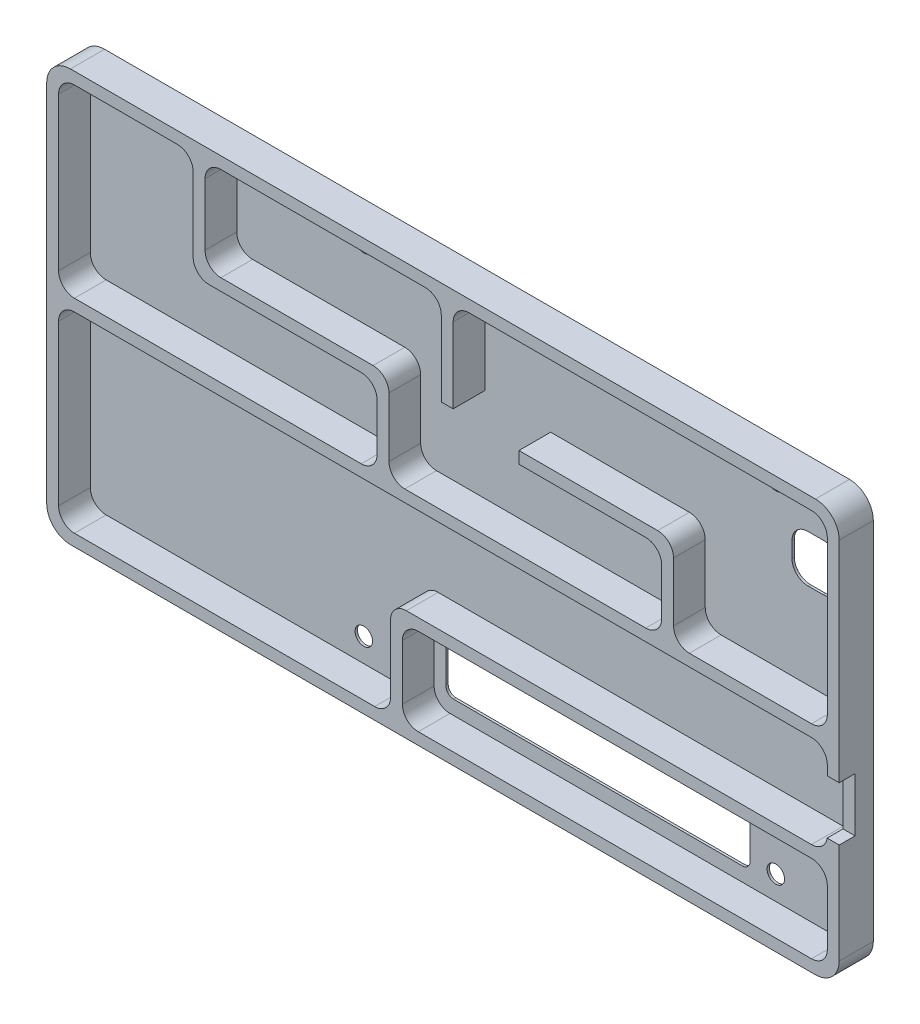
from build123d import *

# Parameters (mm, degrees)
SKETCH_1_W           = 99.974800609
SKETCH_1_H           = 51.97470409
EXTRUDE_1_DEPTH      = 8.6
SKETCH_2_W           = 95.974800609
SKETCH_2_H           = 47.97470409
CUT_EXTRUDE_1_DEPTH  = 4
SKETCH_3_W           = 2
SKETCH_3_H           = 10
SKETCH_3_H_2         = 9.97470409
CUT_EXTRUDE_2_DEPTH  = 3.35
SKETCH_4_R           = 1.1
SKETCH_4_W           = 38.392586289
SKETCH_4_H           = 7.4
SKETCH_4_W_2         = 5.95
SKETCH_4_H_2         = 5.95
CUT_EXTRUDE_3_DEPTH  = 1437.448457956
FILLET_1_R           = 3
FILLET_3_R           = 2
SKETCH_12_W          = 9.000025401
SKETCH_12_H          = 9.0000508
EXTRUDE_3_DEPTH      = 2.7
SKETCH_13_W          = 16.992125984
SKETCH_13_H          = 17.047314393
EXTRUDE_4_DEPTH      = 1.9
SKETCH_7_W           = 53.6
SKETCH_7_H           = 10.97470409
CUT_EXTRUDE_14_DEPTH = 4
FILLET_7_R           = 2
FILLET_8_R           = 1
SKETCH_14_W          = 2.323736835
SKETCH_14_H          = 6.8
CUT_EXTRUDE_15_DEPTH = 2
SKETCH_15_W          = 4.3
SKETCH_15_H          = 51.97470409
CUT_EXTRUDE_16_DEPTH = 1490.156636733


with BuildPart() as part:
    # 草图1 → 凸台-拉伸1 (new body)
    with BuildSketch(Plane.XY.offset(1046.483288979)):
        with Locations((934.375963031, 1020.144466268)):
            Rectangle(SKETCH_1_W, SKETCH_1_H)
    extrude(amount=EXTRUDE_1_DEPTH)

    # 草图2 → 切除-拉伸1 (cut)
    with BuildSketch(Plane(origin=(0, 0, 1046.483288979), x_dir=(-1, 0, 0), z_dir=(0, 0, -1))):
        with Locations((-934.375963031, 1020.144466268)):
            Rectangle(SKETCH_2_W, SKETCH_2_H)
    extrude(amount=-CUT_EXTRUDE_1_DEPTH, mode=Mode.SUBTRACT)

    # 草图3 → 切除-拉伸2 (cut)
    with BuildSketch(Plane(origin=(0, 0, 1046.483288979), x_dir=(-1, 0, 0), z_dir=(0, 0, -1))):
        with Locations((-885.388562726, 1034.131818313)):
            Rectangle(SKETCH_3_W, SKETCH_3_H)
        with Locations((-885.388562726, 1020.144466268)):
            Rectangle(SKETCH_3_W, SKETCH_3_H_2)
        with Locations((-885.388562726, 1006.157114223)):
            Rectangle(SKETCH_3_W, SKETCH_3_H)
    extrude(amount=-CUT_EXTRUDE_2_DEPTH, mode=Mode.SUBTRACT)

    # 草图4 → 切除-拉伸3 (cut, through all)
    with BuildSketch(Plane(origin=(0, 0, 1050.483288979), x_dir=(-1, 0, 0), z_dir=(0, 0, -1))):
        with Locations((-920.388562726, 1041.631818313)):
            Circle(SKETCH_4_R)
        with Locations((-920.388562726, 998.657114223)):
            Circle(SKETCH_4_R)
        with Locations((-972.363363335, 998.657114223)):
            Circle(SKETCH_4_R)
        with Locations((-972.363363335, 1041.631818313)):
            Circle(SKETCH_4_R)
        with Locations((-949.933821712, 1001.144429438)):
            Rectangle(SKETCH_4_W, SKETCH_4_H)
        with Locations((-977.376048121, 1035.144495478)):
            Rectangle(SKETCH_4_W_2, SKETCH_4_H_2)
    extrude(amount=-CUT_EXTRUDE_3_DEPTH, mode=Mode.SUBTRACT)

    # 圆角1
    fillet_1_edges = [part.edges().sort_by_distance(p)[0] for p in [
        (884.388562726, 1046.131818313, 1050.783288979),
        (984.363363335, 1046.131818313, 1050.783288979),
        (984.363363335, 994.157114223, 1050.783288979),
        (884.388562726, 994.157114223, 1050.783288979),
    ]]
    fillet(fillet_1_edges, radius=FILLET_1_R)

    # 圆角3
    fillet_3_edges = [part.edges().sort_by_distance(p)[0] for p in [
        (980.351048121, 1032.169495478, 1052.783288979),
        (980.351048121, 1038.119495478, 1052.783288979),
        (974.401048121, 1038.119495478, 1052.783288979),
        (974.401048121, 1032.169495478, 1052.783288979),
    ]]
    fillet(fillet_3_edges, radius=FILLET_3_R)

    # 草图12 → 凸台-拉伸3 (add)
    with BuildSketch(Plane(origin=(0, 0, 1050.483288979), x_dir=(-1, 0, 0), z_dir=(0, 0, -1))):
        with Locations((-955.369926709, 1022.842410134)):
            Rectangle(SKETCH_12_W, SKETCH_12_H)
    extrude(amount=EXTRUDE_3_DEPTH)

    # 草图13 → 凸台-拉伸4 (add)
    with BuildSketch(Plane(origin=(0, 0, 1050.483288979), x_dir=(-1, 0, 0), z_dir=(0, 0, -1))):
        with Locations((-935.979052947, 1018.778239857)):
            Rectangle(SKETCH_13_W, SKETCH_13_H)
    extrude(amount=EXTRUDE_4_DEPTH)

    # 草图7 → 切除-拉伸14 (cut)
    with BuildSketch(Plane.XY.offset(1055.083288979)):
        Polygon((885.888562726, 1019.831818313), (982.863363335, 1019.831818313), (982.863363335, 1008.131818313), (927.763363335, 1008.131818313), (927.763363335, 1006.631818313), (927.763363335, 995.657114223), (885.888562726, 995.657114223), align=None)
        Polygon((934.163363335, 1044.631818313), (934.163363335, 1033.131818313), (935.663363335, 1033.131818313), (935.663363335, 1044.631818313), (982.863363335, 1044.631818313), (982.863363335, 1021.331818313), (963.463363335, 1021.331818313), (963.463363335, 1032.731818313), (943.963363335, 1032.731818313), (943.963363335, 1031.231818313), (961.963363335, 1031.231818313), (961.963363335, 1021.331818313), (927.563363335, 1021.331818313), (927.563363335, 1032.811818313), (904.363363335, 1032.811818313), (904.363363335, 1044.631818313), align=None)
        with Locations((956.063363335, 1001.144466268)):
            Rectangle(SKETCH_7_W, SKETCH_7_H)
        Polygon((926.063363335, 1021.331818313), (926.063363335, 1031.311818313), (902.863363335, 1031.311818313), (902.863363335, 1044.631818313), (885.888562726, 1044.631818313), (885.888562726, 1021.331818313), align=None)
    extrude(amount=-CUT_EXTRUDE_14_DEPTH, mode=Mode.SUBTRACT)

    # 圆角7
    fillet_7_edges = [part.edges().sort_by_distance(p)[0] for p in [
        (982.363363335, 996.157114223, 1048.483288979),
        (982.363363335, 1044.131818313, 1048.483288979),
        (886.388562726, 1044.131818313, 1048.483288979),
        (886.388562726, 996.157114223, 1048.483288979),
        (982.863363335, 995.657114223, 1053.083288979),
        (929.263363335, 995.657114223, 1053.083288979),
        (929.263363335, 1006.631818313, 1053.083288979),
        (982.863363335, 1006.631818313, 1053.083288979),
        (961.963363335, 1021.331818313, 1053.083288979),
        (927.563363335, 1021.331818313, 1053.083288979),
        (927.563363335, 1032.811818313, 1053.083288979),
        (904.363363335, 1032.811818313, 1053.083288979),
        (904.363363335, 1044.631818313, 1053.083288979),
        (934.163363335, 1044.631818313, 1053.083288979),
        (935.663363335, 1044.631818313, 1053.083288979),
        (982.863363335, 1044.631818313, 1053.083288979),
        (982.863363335, 1021.331818313, 1053.083288979),
        (963.463363335, 1021.331818313, 1053.083288979),
        (963.463363335, 1032.731818313, 1053.083288979),
        (961.963363335, 1031.231818313, 1053.083288979),
        (885.888562726, 1021.331818313, 1053.083288979),
        (885.888562726, 1044.631818313, 1053.083288979),
        (902.863363335, 1044.631818313, 1053.083288979),
        (902.863363335, 1031.311818313, 1053.083288979),
        (926.063363335, 1031.311818313, 1053.083288979),
        (926.063363335, 1021.331818313, 1053.083288979),
        (927.763363335, 995.657114223, 1053.083288979),
        (885.888562726, 995.657114223, 1053.083288979),
        (885.888562726, 1019.831818313, 1053.083288979),
        (982.863363335, 1019.831818313, 1053.083288979),
        (982.863363335, 1008.131818313, 1053.083288979),
        (927.763363335, 1008.131818313, 1053.083288979),
    ]]
    fillet(fillet_7_edges, radius=FILLET_7_R)

    # 圆角8
    fillet_8_edges = [part.edges().sort_by_distance(p)[0] for p in [
        (930.737528567, 997.444429438, 1050.783288979),
        (969.130114856, 997.444429438, 1050.783288979),
        (930.737528567, 1004.844429438, 1050.783288979),
        (969.130114856, 1004.844429438, 1050.783288979),
    ]]
    fillet(fillet_8_edges, radius=FILLET_8_R)

    # 草图14 → 切除-拉伸15 (cut)
    with BuildSketch(Plane.XY.offset(1055.083288979)):
        with Locations((983.201494917, 1013.231818313)):
            Rectangle(SKETCH_14_W, SKETCH_14_H)
    extrude(amount=-CUT_EXTRUDE_15_DEPTH, mode=Mode.SUBTRACT)

    # 草图15 → 切除-拉伸16 (cut, through all)
    with BuildSketch(Plane(origin=(984.363363335, 0, 0), x_dir=(0, 0, -1), z_dir=(1, 0, 0))):
        with Locations((-1048.633288979, 1020.144466268)):
            Rectangle(SKETCH_15_W, SKETCH_15_H)
    extrude(amount=-CUT_EXTRUDE_16_DEPTH, mode=Mode.SUBTRACT)


solid = part.part
